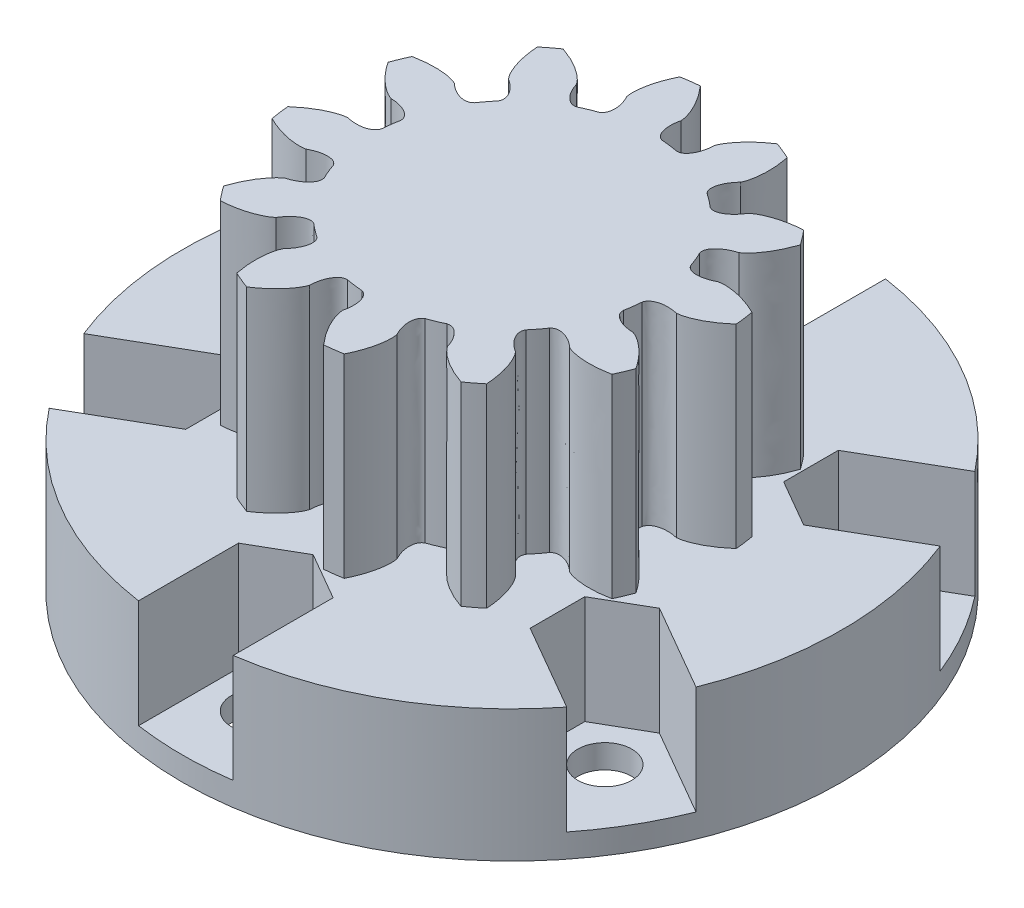
from build123d import *

# Parameters (mm, degrees)
SKETCH6_R           = 19.5
BOSS_EXTRUDE1_DEPTH = 7.8
SKETCH7_R           = 12.25
BOSS_EXTRUDE2_DEPTH = 11.5
CUT_EXTRUDE1_DEPTH  = 11.5
CIRPATTERN1_COUNT   = 12
CUT_EXTRUDE2_START  = -6.4
SKETCH16_R          = 1.6
CUT_EXTRUDE2_DEPTH  = 6.4
SKETCH16_3_R        = 1.6
CUT_EXTRUDE3_DEPTH  = 30.87892244


with BuildPart() as part:
    # Sketch6 → Boss-Extrude1 (new body)
    with BuildSketch(Plane(origin=(0, 0, 0), x_dir=(1, 0, 0), z_dir=(0, 1, 0))):
        with Locations(Location((0, 0, 0), (0, 0, 270))):
            Circle(SKETCH6_R)
    extrude(amount=BOSS_EXTRUDE1_DEPTH)

    # Sketch7 → Boss-Extrude2 (add)
    with BuildSketch(Plane(origin=(0, 7.8, 0), x_dir=(1, 0, 0), z_dir=(0, 1, 0))):
        with Locations(Location((0, 0, 0), (0, 0, 270))):
            Circle(SKETCH7_R)
    extrude(amount=BOSS_EXTRUDE2_DEPTH)

    # Sketch11 → Cut-Extrude1 (cut)
    with BuildSketch(Plane(origin=(0, 7.8, 0), x_dir=(1, 0, 0), z_dir=(0, 1, 0))):
        with BuildLine():
            ThreePointArc((0.595355642, 8.291152387), (1.084998973, 8.24138541), (1.570838753, 8.162727599))
            add(Edge.make_bspline(
                [(2.411382985, 9.567571898), (2.40463462, 9.331229416), (2.351486865, 8.971522053), (2.106267653, 8.430021701), (1.837364875, 8.156257167), (1.570838753, 8.162727599)],
                knots=[0, 0, 0, 0, 0.4, 0.6, 1, 1, 1, 1], degree=3))
            add(Edge.make_bspline(
                [(5.309119248, 12.138100083), (4.880893096, 11.942612769), (4.294430324, 11.617351965), (3.624492866, 11.111678852), (3.244059526, 10.767712519), (2.947665251, 10.448616844), (2.653498529, 10.06749798), (2.479124318, 9.77501179), (2.411382985, 9.567571898)],
                knots=[0, 0, 0, 0, 0.356747268, 0.505732375, 0.635125132, 0.744925545, 0.83513362, 1, 1, 1, 1], degree=3))
            ThreePointArc((5.309119248, 12.138100083), (1.729263787, 13.135062526), (-1.986643923, 13.098605526))
            add(Edge.make_bspline(
                [(-1.986643923, 13.098605526), (-1.623605063, 12.798946197), (-1.141309217, 12.332980652), (-0.625077156, 11.671145359), (-0.346631806, 11.240436001), (-0.142924959, 10.855500764), (0.042577455, 10.411232261), (0.135309012, 10.083580929), (0.147052721, 9.865676633)],
                knots=[0, 0, 0, 0, 0.356747268, 0.505732375, 0.635125132, 0.744925545, 0.83513362, 1, 1, 1, 1], degree=3))
            add(Edge.make_bspline(
                [(0.147052721, 9.865676633), (0.092401205, 9.63564072), (0.050638878, 9.274434437), (0.147351844, 8.68791786), (0.336236507, 8.353884466), (0.595355642, 8.291152387)],
                knots=[0, 0, 0, 0, 0.4, 0.6, 1, 1, 1, 1], degree=3))
        make_face()
    cut_extrude1 = extrude(amount=CUT_EXTRUDE1_DEPTH, mode=Mode.SUBTRACT)

    # CirPattern1: Cut-Extrude1 ×12 about axis
    cirpattern1_axis = Axis((0, 19.3, 0), (0, -1, 0))
    for i in range(1, CIRPATTERN1_COUNT):
        add(cut_extrude1.rotate(cirpattern1_axis, i * 360 / CIRPATTERN1_COUNT), mode=Mode.SUBTRACT)

    # Sketch16 → Cut-Extrude2 (cut)
    # profile 1 of 6: a face of its own
    with BuildSketch(Plane(origin=(0, 7.8, 0), x_dir=(1, 0, 0), z_dir=(0, 1, 0)).offset(CUT_EXTRUDE2_START)):
        with BuildLine():
            Line((2.8, 16.616580754), (2.8, 19.29792735))
            ThreePointArc((2.8, 19.29792735), (0, 19.5), (-2.8, 19.29792735))
            Line((-2.8, 19.29792735), (-2.8, 16.616580754))
            Line((-2.8, 16.616580754), (-2.8, 13.383419246))
            Line((-2.8, 13.383419246), (0, 11.766838493))
            Line((0, 11.766838493), (2.8, 13.383419246))
            Line((2.8, 13.383419246), (2.8, 16.616580754))
        make_face()
        with Locations(Location((0, 15, 0), (0, 0, 270))):
            Circle(SKETCH16_R, mode=Mode.SUBTRACT)
    # profile 2 of 6: a face of its own
    with BuildSketch(Plane(origin=(0, 7.8, 0), x_dir=(1, 0, 0), z_dir=(0, 1, 0)).offset(CUT_EXTRUDE2_START)):
        with BuildLine():
            Line((15.790381057, 5.883419246), (18.112495325, 7.224092544))
            ThreePointArc((18.112495325, 7.224092544), (16.887495374, 9.75), (15.312495325, 12.073834806))
            Line((15.312495325, 12.073834806), (12.990381057, 10.733161507))
            Line((12.990381057, 10.733161507), (10.190381057, 9.116580754))
            Line((10.190381057, 9.116580754), (10.190381057, 5.883419246))
            Line((10.190381057, 5.883419246), (12.990381057, 4.266838493))
            Line((12.990381057, 4.266838493), (15.790381057, 5.883419246))
        make_face()
        with Locations(Location((12.990381057, 7.5, 0), (0, 0, 270))):
            Circle(SKETCH16_R, mode=Mode.SUBTRACT)
    # profile 3 of 6: a face of its own
    with BuildSketch(Plane(origin=(0, 7.8, 0), x_dir=(1, 0, 0), z_dir=(0, 1, 0)).offset(CUT_EXTRUDE2_START)):
        with BuildLine():
            Line((12.990381057, -10.733161507), (15.312495325, -12.073834806))
            ThreePointArc((15.312495325, -12.073834806), (16.887495374, -9.75), (18.112495325, -7.224092544))
            Line((18.112495325, -7.224092544), (15.790381057, -5.883419246))
            Line((15.790381057, -5.883419246), (12.990381057, -4.266838493))
            Line((12.990381057, -4.266838493), (10.190381057, -5.883419246))
            Line((10.190381057, -5.883419246), (10.190381057, -9.116580754))
            Line((10.190381057, -9.116580754), (12.990381057, -10.733161507))
        make_face()
        with Locations(Location((12.990381057, -7.5, 0), (0, 0, 270))):
            Circle(SKETCH16_R, mode=Mode.SUBTRACT)
    # profile 4 of 6: a face of its own
    with BuildSketch(Plane(origin=(0, 7.8, 0), x_dir=(1, 0, 0), z_dir=(0, 1, 0)).offset(CUT_EXTRUDE2_START)):
        with BuildLine():
            Line((-2.8, -16.616580754), (-2.8, -19.29792735))
            ThreePointArc((-2.8, -19.29792735), (0, -19.5), (2.8, -19.29792735))
            Line((2.8, -19.29792735), (2.8, -16.616580754))
            Line((2.8, -16.616580754), (2.8, -13.383419246))
            Line((2.8, -13.383419246), (0, -11.766838493))
            Line((0, -11.766838493), (-2.8, -13.383419246))
            Line((-2.8, -13.383419246), (-2.8, -16.616580754))
        make_face()
        with Locations(Location((0, -15, 0), (0, 0, 270))):
            Circle(SKETCH16_R, mode=Mode.SUBTRACT)
    # profile 5 of 6: a face of its own
    with BuildSketch(Plane(origin=(0, 7.8, 0), x_dir=(1, 0, 0), z_dir=(0, 1, 0)).offset(CUT_EXTRUDE2_START)):
        with BuildLine():
            Line((-15.790381057, -5.883419246), (-18.112495325, -7.224092544))
            ThreePointArc((-18.112495325, -7.224092544), (-16.887495374, -9.75), (-15.312495325, -12.073834806))
            Line((-15.312495325, -12.073834806), (-12.990381057, -10.733161507))
            Line((-12.990381057, -10.733161507), (-10.190381057, -9.116580754))
            Line((-10.190381057, -9.116580754), (-10.190381057, -5.883419246))
            Line((-10.190381057, -5.883419246), (-12.990381057, -4.266838493))
            Line((-12.990381057, -4.266838493), (-15.790381057, -5.883419246))
        make_face()
        with Locations(Location((-12.990381057, -7.5, 0), (0, 0, 270))):
            Circle(SKETCH16_R, mode=Mode.SUBTRACT)
    # profile 6 of 6: a face of its own
    with BuildSketch(Plane(origin=(0, 7.8, 0), x_dir=(1, 0, 0), z_dir=(0, 1, 0)).offset(CUT_EXTRUDE2_START)):
        with BuildLine():
            Line((-12.990381057, 10.733161507), (-15.312495325, 12.073834806))
            ThreePointArc((-15.312495325, 12.073834806), (-16.887495374, 9.75), (-18.112495325, 7.224092544))
            Line((-18.112495325, 7.224092544), (-15.790381057, 5.883419246))
            Line((-15.790381057, 5.883419246), (-12.990381057, 4.266838493))
            Line((-12.990381057, 4.266838493), (-10.190381057, 5.883419246))
            Line((-10.190381057, 5.883419246), (-10.190381057, 9.116580754))
            Line((-10.190381057, 9.116580754), (-12.990381057, 10.733161507))
        make_face()
        with Locations(Location((-12.990381057, 7.5, 0), (0, 0, 270))):
            Circle(SKETCH16_R, mode=Mode.SUBTRACT)
    extrude(amount=CUT_EXTRUDE2_DEPTH, mode=Mode.SUBTRACT)

    # Sketch16<3> → Cut-Extrude3 (cut, through all)
    with BuildSketch(Plane(origin=(0, 7.8, 0), x_dir=(1, 0, 0), z_dir=(0, 1, 0))):
        with Locations(Location((0, 15, 0), (0, 0, 270))):
            Circle(SKETCH16_3_R)
        with Locations(Location((12.990381057, 7.5, 0), (0, 0, 270))):
            Circle(SKETCH16_3_R)
        with Locations(Location((12.990381057, -7.5, 0), (0, 0, 270))):
            Circle(SKETCH16_3_R)
        with Locations(Location((0, -15, 0), (0, 0, 270))):
            Circle(SKETCH16_3_R)
        with Locations(Location((-12.990381057, -7.5, 0), (0, 0, 270))):
            Circle(SKETCH16_3_R)
        with Locations(Location((-12.990381057, 7.5, 0), (0, 0, 270))):
            Circle(SKETCH16_3_R)
    extrude(amount=-CUT_EXTRUDE3_DEPTH, mode=Mode.SUBTRACT)


solid = part.part
